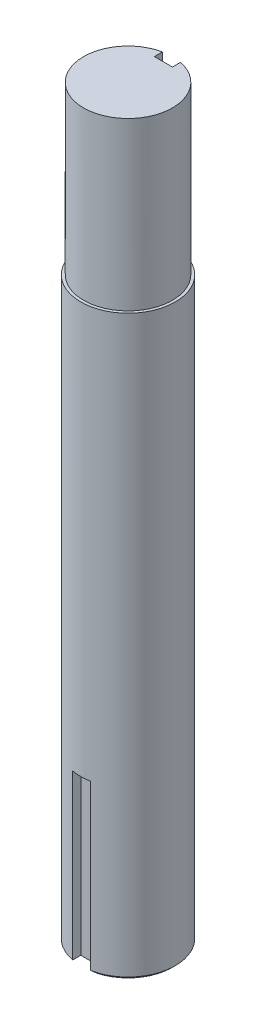
from build123d import *

# Parameters (mm, degrees)
SKETCH1_W          = 8.5
SKETCH1_H          = 134
SKETCH2_W          = 3.25
SKETCH2_H          = 3.25
CUT_EXTRUDE1_DEPTH = 30
CHAMFER1_SIZE      = 0.5
SKETCH4_OUTSIDE_W  = 46.228
SKETCH4_OUTSIDE_H  = 46.228
SKETCH4_OUTSIDE_R  = 8
CUT_EXTRUDE3_DEPTH = 30
SKETCH3_W          = 3.25
SKETCH3_H          = 3.25
CUT_EXTRUDE2_DEPTH = 25


with BuildPart() as part:
    # Sketch1 → Revolve1 (revolve)
    with BuildSketch(Plane.XY, mode=Mode.PRIVATE) as revolve1_sk:
        with Locations((4.25, 67)):
            Rectangle(SKETCH1_W, SKETCH1_H)
    revolve(revolve1_sk.sketch.rotate(Axis((0, 134, 0), (0, -1, 0)), 90), axis=Axis((0, 134, 0), (0, -1, 0)))

    # Sketch2 → Cut-Extrude1 (cut)
    with BuildSketch(Plane.XZ):
        with Locations((0, 8.5)):
            Rectangle(SKETCH2_W, SKETCH2_H)
    extrude(amount=-CUT_EXTRUDE1_DEPTH, mode=Mode.SUBTRACT)

    # Chamfer1
    chamfer1_edges = [part.edges().sort_by_distance(p)[0] for p in [
        (1.625, 0, 7.609111649),
        (0, 0, 6.875),
        (0, 0, -8.5),
        (0, 134, -8.5),
        (-1.625, 0, 7.609111649),
    ]]
    chamfer(chamfer1_edges, length=CHAMFER1_SIZE)

    # Sketch4 outside → Cut-Extrude3 (cut)
    with BuildSketch(Plane(origin=(0, 134, 0), x_dir=(1, 0, 0), z_dir=(0, 1, 0))):
        Rectangle(SKETCH4_OUTSIDE_W, SKETCH4_OUTSIDE_H)
        with Locations(Location((0, 0, 0), (0, 0, 180))):
            Circle(SKETCH4_OUTSIDE_R, mode=Mode.SUBTRACT)
    extrude(amount=-CUT_EXTRUDE3_DEPTH, mode=Mode.SUBTRACT)

    # Sketch3 → Cut-Extrude2 (cut)
    with BuildSketch(Plane(origin=(0, 134, 0), x_dir=(1, 0, 0), z_dir=(0, 1, 0))):
        with Locations((0, 8)):
            Rectangle(SKETCH3_W, SKETCH3_H)
    extrude(amount=-CUT_EXTRUDE2_DEPTH, mode=Mode.SUBTRACT)


solid = part.part
